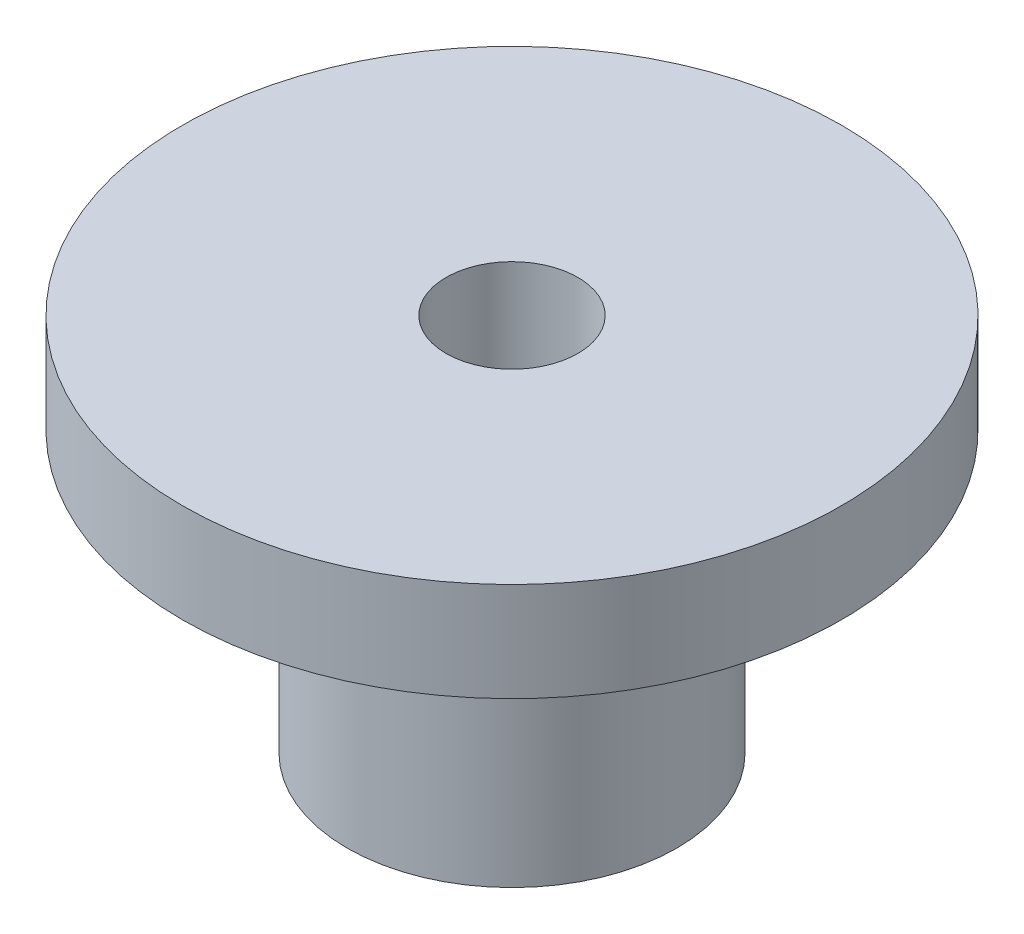
from build123d import *

# Parameters (mm, degrees)
SKETCH_1_R      = 5
SKETCH_1_R_2    = 2
EXTRUDE_1_DEPTH = 8.5
SKETCH_2_R      = 10
SKETCH_2_R_2    = 2
EXTRUDE_2_DEPTH = 3


with BuildPart() as part:
    # 草图1 → 凸台-拉伸1 (new body)
    with BuildSketch(Plane(origin=(0, 0, 0), x_dir=(1, 0, 0), z_dir=(0, 1, 0))):
        with Locations(Location((0, 0, 0), (0, 0, 270))):
            Circle(SKETCH_1_R)
        with Locations(Location((0, 0, 0), (0, 0, 270))):
            Circle(SKETCH_1_R_2, mode=Mode.SUBTRACT)
    extrude(amount=EXTRUDE_1_DEPTH)

    # 草图2 → 凸台-拉伸2 (add)
    with BuildSketch(Plane(origin=(0, 8.5, 0), x_dir=(1, 0, 0), z_dir=(0, 1, 0))):
        with Locations(Location((0, 0, 0), (0, 0, 270))):
            Circle(SKETCH_2_R)
        with Locations(Location((0, 0, 0), (0, 0, 270))):
            Circle(SKETCH_2_R_2, mode=Mode.SUBTRACT)
    extrude(amount=EXTRUDE_2_DEPTH)


solid = part.part
